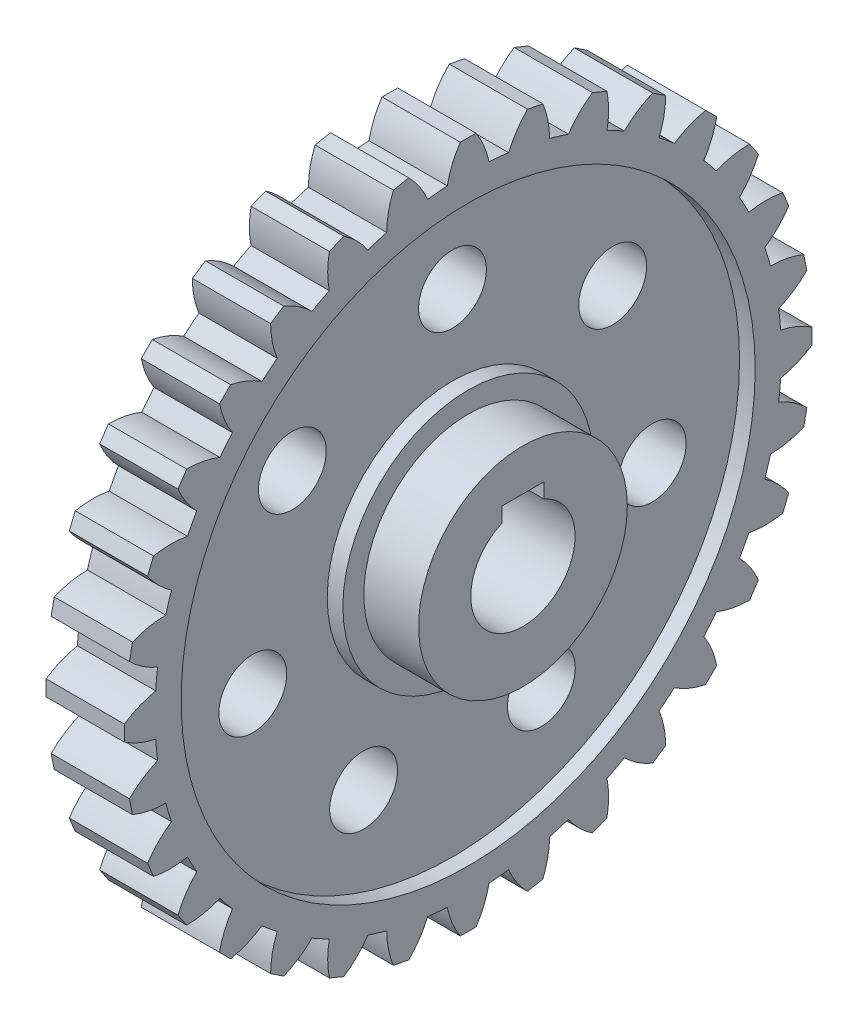
from build123d import *

# Parameters (mm, degrees)
SKETCH1_R           = 60
BOSS_EXTRUDE1_DEPTH = 7.5
BOSS_EXTRUDE2_DEPTH = 15
CIRPATTERN1_COUNT   = 32
SKETCH7_R           = 20
BOSS_EXTRUDE5_DEPTH = 18
CUT_EXTRUDE4_DEPTH  = 100.863889552
SKETCH9_R           = 55
SKETCH9_R_2         = 24
CUT_EXTRUDE5_DEPTH  = 3
SKETCH10_R          = 6.5
CUT_EXTRUDE6_DEPTH  = 96.828213155


with BuildPart() as part:
    # Sketch1 → Boss-Extrude1 (new, symmetric)
    with BuildSketch(Plane(origin=(0, 0, 0), x_dir=(0, 0, -1), z_dir=(1, 0, 0))):
        Circle(SKETCH1_R)
    extrude(amount=BOSS_EXTRUDE1_DEPTH, both=True)

    # Sketch2 → Boss-Extrude2 (add)
    with BuildSketch(Plane(origin=(7.5, 0, 0), x_dir=(0, 0, -1), z_dir=(1, 0, 0))):
        with BuildLine():
            Line((-1.5, 65.866518188), (1.5, 65.866518188))
            ThreePointArc((1.5, 65.866518188), (3.039433911, 62.987115651), (4, 59.866518188))
            ThreePointArc((4, 59.866518188), (0, 60), (-4, 59.866518188))
            ThreePointArc((-4, 59.866518188), (-3.039433911, 62.987115651), (-1.5, 65.866518188))
        make_face()
    boss_extrude2 = extrude(amount=-BOSS_EXTRUDE2_DEPTH)

    # CirPattern1: Boss-Extrude2 ×32 about axis
    cirpattern1_axis = Axis((0, 0, 0), (1, 0, 0))
    for i in range(1, CIRPATTERN1_COUNT):
        add(boss_extrude2.rotate(cirpattern1_axis, i * 360 / CIRPATTERN1_COUNT))

    # Sketch7 → Boss-Extrude5 (add, symmetric)
    with BuildSketch(Plane(origin=(0, 0, 0), x_dir=(0, 0, -1), z_dir=(1, 0, 0))):
        Circle(SKETCH7_R)
    extrude(amount=BOSS_EXTRUDE5_DEPTH, both=True)

    # Sketch8 → Cut-Extrude4 (cut, through all)
    with BuildSketch(Plane(origin=(18, 0, 0), x_dir=(0, 0, -1), z_dir=(1, 0, 0))):
        with BuildLine():
            Line((-4, 12), (4, 12))
            Line((4, 12), (4, 9.16515139))
            ThreePointArc((4, 9.16515139), (0, -10), (-4, 9.16515139))
            Line((-4, 9.16515139), (-4, 12))
        make_face()
    extrude(amount=-CUT_EXTRUDE4_DEPTH, mode=Mode.SUBTRACT)

    # Sketch9 → Cut-Extrude5 (cut)
    with BuildSketch(Plane(origin=(7.5, 0, 0), x_dir=(0, 0, -1), z_dir=(1, 0, 0))):
        Circle(SKETCH9_R)
        Circle(SKETCH9_R_2, mode=Mode.SUBTRACT)
    extrude(amount=-CUT_EXTRUDE5_DEPTH, mode=Mode.SUBTRACT)

    # Sketch10 → Cut-Extrude6 (cut, through all)
    with BuildSketch(Plane(origin=(4.5, 0, 0), x_dir=(0, 0, -1), z_dir=(1, 0, 0))):
        with Locations((0, 39.25)):
            Circle(SKETCH10_R)
        with Locations((30.686885687, 24.471974723)):
            Circle(SKETCH10_R)
        with Locations((38.265920553, -8.733946658)):
            Circle(SKETCH10_R)
        with Locations((17.02993676, -35.363028065)):
            Circle(SKETCH10_R)
        with Locations((-17.02993676, -35.363028065)):
            Circle(SKETCH10_R)
        with Locations((-38.265920553, -8.733946658)):
            Circle(SKETCH10_R)
        with Locations((-30.686885687, 24.471974723)):
            Circle(SKETCH10_R)
    extrude(amount=-CUT_EXTRUDE6_DEPTH, mode=Mode.SUBTRACT)


solid = part.part
